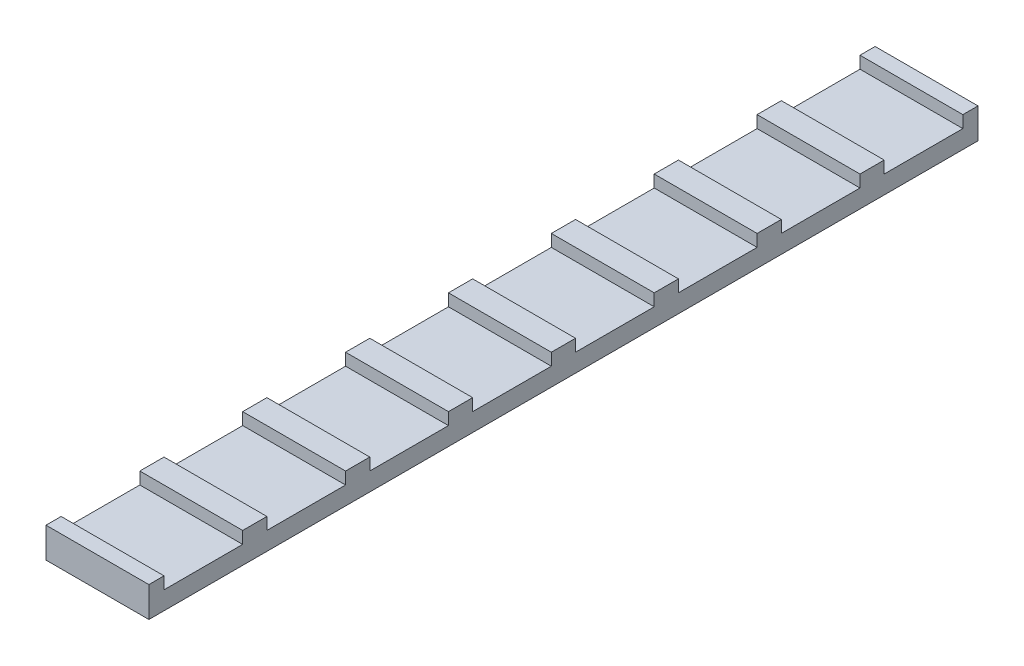
from build123d import *

# Parameters (mm, degrees)
SKETCH1_W           = 17
SKETCH1_H           = 137
BOSS_EXTRUDE1_DEPTH = 5
SKETCH2_W           = 17
SKETCH2_H           = 13
CUT_EXTRUDE1_DEPTH  = 2
LPATTERN1_COUNT     = 8
LPATTERN1_PITCH     = 17


with BuildPart() as part:
    # Sketch1 → Boss-Extrude1 (new body)
    with BuildSketch(Plane(origin=(0, 0, 0), x_dir=(1, 0, 0), z_dir=(0, 1, 0))):
        Rectangle(SKETCH1_W, SKETCH1_H)
    extrude(amount=BOSS_EXTRUDE1_DEPTH)

    # Sketch2 → Cut-Extrude1 (cut)
    with BuildSketch(Plane(origin=(0, 5, 0), x_dir=(1, 0, 0), z_dir=(0, 1, 0))):
        with Locations((0, 59.5)):
            Rectangle(SKETCH2_W, SKETCH2_H)
    cut_extrude1 = extrude(amount=-CUT_EXTRUDE1_DEPTH, mode=Mode.SUBTRACT)

    # LPattern1: Cut-Extrude1 ×8
    with Locations(*[(0, 0, i * LPATTERN1_PITCH) for i in range(1, LPATTERN1_COUNT)]):
        add(cut_extrude1, mode=Mode.SUBTRACT)


solid = part.part
